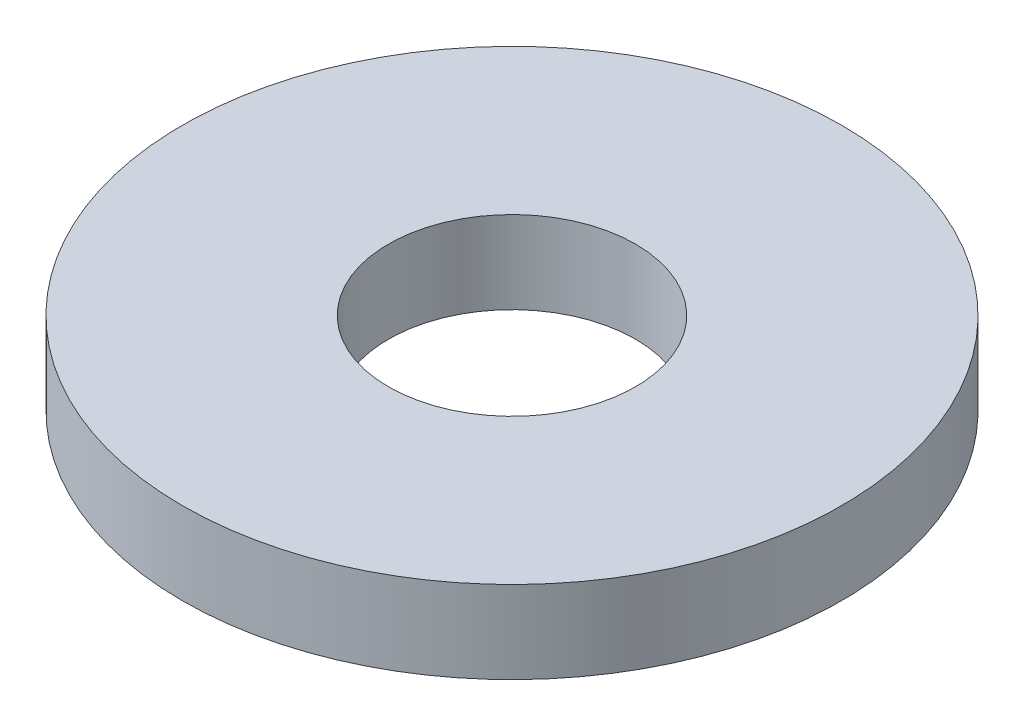
from build123d import *

# Parameters (mm, degrees)
SKETCH_1_R      = 4
SKETCH_1_R_2    = 1.5
EXTRUDE_1_DEPTH = 1


with BuildPart() as part:
    # 草图1 → 凸台-拉伸1 (new body)
    with BuildSketch(Plane(origin=(0, 0, 0), x_dir=(1, 0, 0), z_dir=(0, 1, 0))):
        with Locations(Location((0, 0, 0), (0, 0, 270))):
            Circle(SKETCH_1_R)
        with Locations(Location((0, 0, 0), (0, 0, 270))):
            Circle(SKETCH_1_R_2, mode=Mode.SUBTRACT)
    extrude(amount=EXTRUDE_1_DEPTH)


solid = part.part
